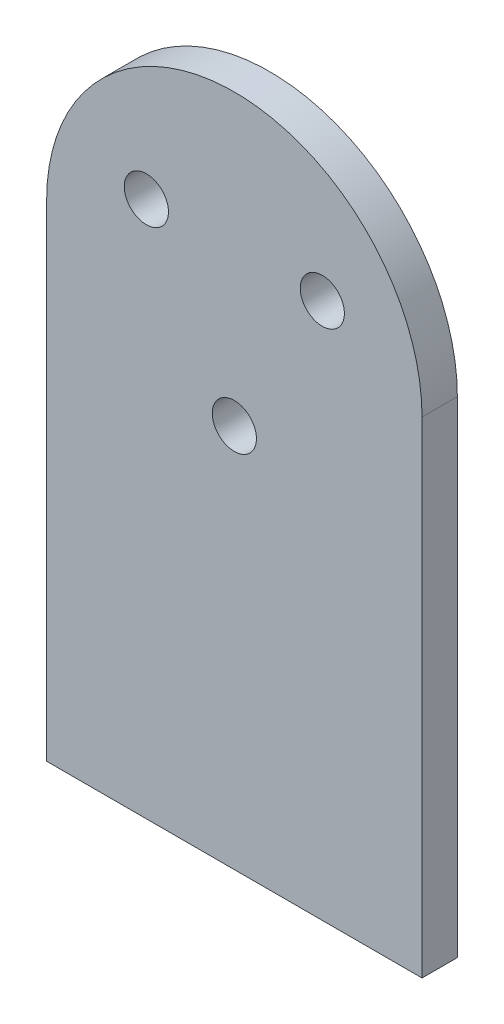
from build123d import *

# Parameters (mm, degrees)
SKETCH1_R           = 0.5
BOSS_EXTRUDE1_DEPTH = 0.8


with BuildPart() as part:
    # Sketch1 → Boss-Extrude1 (new body)
    with BuildSketch(Plane.XY):
        with BuildLine():
            Line((4.25, 0), (4.25, -11))
            Line((4.25, -11), (-4.25, -11))
            Line((-4.25, -11), (-4.25, 0))
            ThreePointArc((-4.25, 0), (0, 4.25), (4.25, 0))
        make_face()
        with Locations((0, -2.3)):
            Circle(SKETCH1_R, mode=Mode.SUBTRACT)
        with Locations((-1.991858429, 1.15)):
            Circle(SKETCH1_R, mode=Mode.SUBTRACT)
        with Locations((1.991858429, 1.15)):
            Circle(SKETCH1_R, mode=Mode.SUBTRACT)
    extrude(amount=BOSS_EXTRUDE1_DEPTH)


solid = part.part
